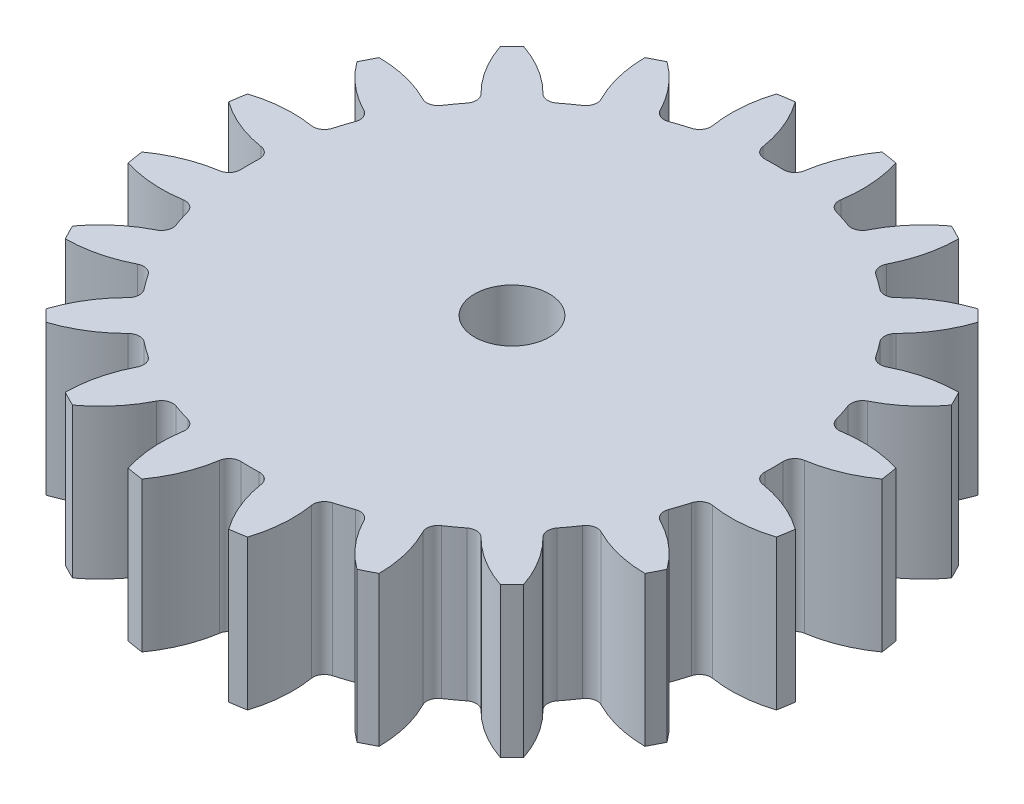
from build123d import *

# Parameters (mm, degrees)
SKETCH1_R                = 22
SKETCH1_R_2              = 2.5
BOSS_EXTRUDE1_DEPTH      = 10
CUT_EXTRUDE1_DEPTH       = 33.680269277
FILLET1_R                = 0.76
CIRPATTERN2_COUNT        = 20
FILLET1_OF_CIRPATTERN2_R = 0.76


with BuildPart() as part:
    # Sketch1 → Boss-Extrude1 (new body)
    with BuildSketch(Plane(origin=(0, 0, 0), x_dir=(1, 0, 0), z_dir=(0, 1, 0))):
        with Locations(Location((0, 0, 0), (0, 0, 270))):
            Circle(SKETCH1_R)
        with Locations(Location((0, 0, 0), (0, 0, 270))):
            Circle(SKETCH1_R_2, mode=Mode.SUBTRACT)
    extrude(amount=BOSS_EXTRUDE1_DEPTH)

    # Sketch2 → Cut-Extrude1 (cut, through all)
    with BuildSketch(Plane(origin=(0, 10, 0), x_dir=(1, 0, 0), z_dir=(0, 1, 0))):
        with BuildLine():
            ThreePointArc((1.310279948, 17.450878673), (0, 17.5), (-1.310279948, 17.450878673))
            ThreePointArc((-1.310279948, 17.450878673), (-1.802788979, 19.73907503), (-2.89632944, 21.808513837))
            ThreePointArc((-2.89632944, 21.808513837), (0, 22), (2.89632944, 21.808513837))
            ThreePointArc((2.89632944, 21.808513837), (1.802788979, 19.73907503), (1.310279948, 17.450878673))
        make_face()
    cut_extrude1 = extrude(amount=-CUT_EXTRUDE1_DEPTH, mode=Mode.SUBTRACT)

    # Fillet1
    fillet1_edges = [part.edges().sort_by_distance(p)[0] for p in [
        (-1.310279948, 5, -17.450878673),
        (1.310279948, 5, -17.450878673),
    ]]
    fillet(fillet1_edges, radius=FILLET1_R)

    # CirPattern2: Cut-Extrude1 ×20 about axis
    cirpattern2_axis = Axis((0, 0, 0), (0, 1, 0))
    for i in range(1, CIRPATTERN2_COUNT):
        add(cut_extrude1.rotate(cirpattern2_axis, i * 360 / CIRPATTERN2_COUNT), mode=Mode.SUBTRACT)

    # Fillet1 of CirPattern2
    fillet1_of_cirpattern2_edges = [part.edges().sort_by_distance(p)[0] for p in [
        (-6.63876836, 5, -16.191873106),
        (-4.146467794, 5, -17.001670648),
        (-11.317407869, 5, -13.347894183),
        (-9.197330378, 5, -14.888220643),
        (-14.888220643, 5, -9.197330378),
        (-13.347894183, 5, -11.317407869),
        (-17.001670648, 5, -4.146467794),
        (-16.191873106, 5, -6.63876836),
        (-17.450878673, 5, 1.310279948),
        (-17.450878673, 5, -1.310279948),
        (-16.191873106, 5, 6.63876836),
        (-17.001670648, 5, 4.146467794),
        (-13.347894183, 5, 11.317407869),
        (-14.888220643, 5, 9.197330378),
        (-9.197330378, 5, 14.888220643),
        (-11.317407869, 5, 13.347894183),
        (-4.146467794, 5, 17.001670648),
        (-6.63876836, 5, 16.191873106),
        (1.310279948, 5, 17.450878673),
        (-1.310279948, 5, 17.450878673),
        (6.63876836, 5, 16.191873106),
        (4.146467794, 5, 17.001670648),
        (11.317407869, 5, 13.347894183),
        (9.197330378, 5, 14.888220643),
        (14.888220643, 5, 9.197330378),
        (13.347894183, 5, 11.317407869),
        (17.001670648, 5, 4.146467794),
        (16.191873106, 5, 6.63876836),
        (17.450878673, 5, -1.310279948),
        (17.450878673, 5, 1.310279948),
        (16.191873106, 5, -6.63876836),
        (17.001670648, 5, -4.146467794),
        (13.347894183, 5, -11.317407869),
        (14.888220643, 5, -9.197330378),
        (9.197330378, 5, -14.888220643),
        (11.317407869, 5, -13.347894183),
        (4.146467794, 5, -17.001670648),
        (6.63876836, 5, -16.191873106),
    ]]
    fillet(fillet1_of_cirpattern2_edges, radius=FILLET1_OF_CIRPATTERN2_R)


solid = part.part
